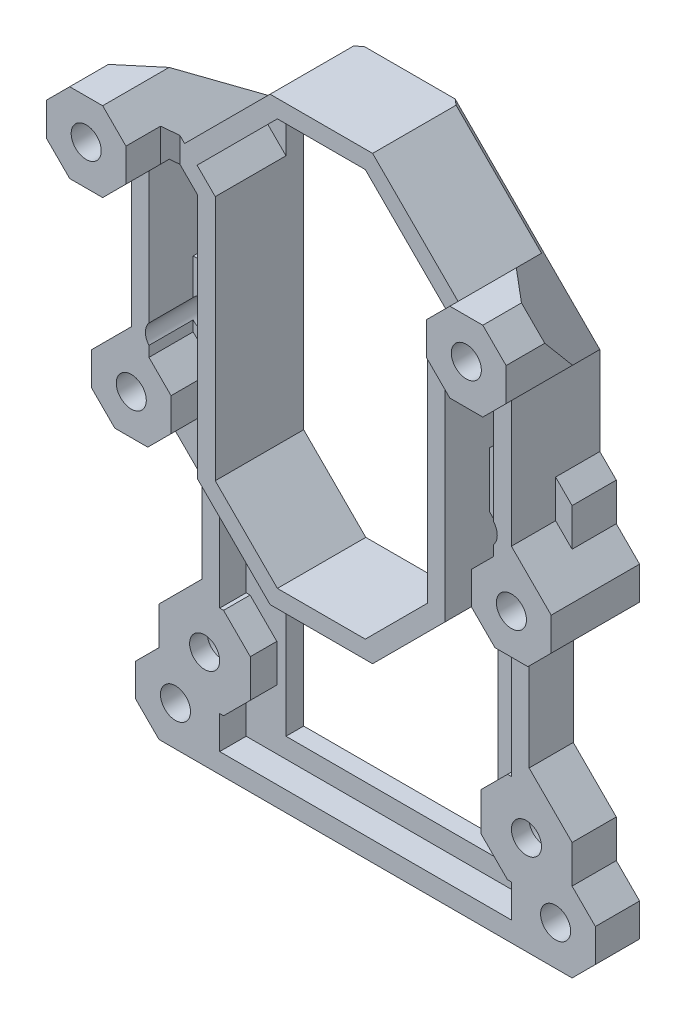
from build123d import *

# Parameters (mm, degrees)
SKETCH5_R               = 1.6999999999999995
BOSS_EXTRUDE1_DEPTH     = 2
SKETCH9_R               = 1.6999999999999995
BOSS_EXTRUDE3_DEPTH     = 3
SKETCH10_R              = 1.6999999999999995
BOSS_EXTRUDE4_DEPTH     = 5
BOSS_EXTRUDE5_DEPTH     = 5.1
SKETCH13_R              = 1.6999999999999995
SUSPENSION_DOWELS_DEPTH = 3.75
TOP_ANGLE_1_DEPTH       = 25
TOP_ANGLE_2_DEPTH       = 25
CHAMFER1_SIZE           = 1
CHAMFER1_SIZE2          = 1.1917535925942147
CHAMFER1_PART_2_SIZE    = 1
CHAMFER1_PART_2_SIZE2   = 1.1917535925942147
CHAMFER1_PART_3_SIZE    = 1
CHAMFER1_PART_3_SIZE2   = 1.1917535925942147
CHAMFER1_PART_4_SIZE    = 1
CHAMFER1_PART_4_SIZE2   = 1.1917535925942147
CHAMFER1_PART_5_SIZE    = 1
CHAMFER1_PART_5_SIZE2   = 1.1917535925942147
CHAMFER1_PART_6_SIZE    = 1
CHAMFER1_PART_6_SIZE2   = 1.1917535925942147
SKETCH18_R              = 3.0000000000000018
SKETCH18_R_2            = 2.9999999999999973
SKETCH18_R_3            = 3
SKETCH18_R_4            = 2.999999999999999
M3_HEAD_HOLES_DEPTH     = 3


with BuildPart() as part:
    # Sketch5 → Boss-Extrude1 (new body)
    with BuildSketch(Plane.XY):
        Polygon((19.636038969321074, -4.4999999999999964), (-19.636038969321074, -4.4999999999999964), (-23.363961030678926, -4.499999999999997), (-25.999999999999996, -1.8639610306789332), (-25.999999999999996, 1.863961030678925), (-23.36396103067893, 4.5), (-23.363961030678933, 8.77796538894672), (-20.33898269447335, 11.802943725152302), (-18.499999999999996, 13.641926419625662), (-18.500000000000004, 23.63603896932108), (-23.363961030678926, 28.499999999999996), (-25.999999999999996, 31.13603896932107), (-26, 34.86396103067893), (-23.363961030678926, 37.5), (-23.363961030678926, 41.7779653889467), (-21.5, 43.64192641962563), (-21.5, 53.63603896932107), (-23.363961030678908, 55.499999999999964), (-26.000000000000004, 58.13603896932106), (-26.000000000000004, 61.86396103067894), (-23.36396103067892, 64.50000000000001), (-19.63603896932107, 64.50000000000001), (-16.999999999999986, 61.86396103067893), (-15.4675144212722, 60.33147545195113), (-5.798989873223339, 69.99999999999999), (5.798989873223339, 69.99999999999999), (15.4675144212722, 60.33147545195113), (16.999999999999986, 61.86396103067893), (19.63603896932107, 64.50000000000001), (23.36396103067892, 64.50000000000001), (26.000000000000004, 61.86396103067894), (26.000000000000004, 58.13603896932106), (23.363961030678908, 55.499999999999964), (21.5, 53.63603896932107), (21.5, 43.64192641962563), (23.363961030678926, 41.7779653889467), (23.363961030678926, 37.5), (26, 34.86396103067893), (25.999999999999996, 31.13603896932107), (23.363961030678926, 28.499999999999996), (18.500000000000004, 23.63603896932108), (18.499999999999996, 13.641926419625662), (20.33898269447335, 11.802943725152302), (23.363961030678933, 8.77796538894672), (23.36396103067893, 4.5), (25.999999999999996, 1.863961030678925), (25.999999999999996, -1.8639610306789332), (23.363961030678926, -4.499999999999997), align=None)
        with Locations((-18.2, 39.638982694473334)):
            Circle(SKETCH5_R, mode=Mode.SUBTRACT)
        with Locations((-18.199999999999996, 6.638982694473367)):
            Circle(SKETCH5_R, mode=Mode.SUBTRACT)
        with Locations(Location((18.199999999999996, 6.638982694473367, 0), (0, 0, 180))):
            Circle(SKETCH5_R, mode=Mode.SUBTRACT)
        with Locations(Location((18.2, 39.638982694473334, 0), (0, 0, 180))):
            Circle(SKETCH5_R, mode=Mode.SUBTRACT)
        Polygon((4.9705627484771515, 67.99999999999999), (-4.9705627484771515, 67.99999999999999), (-12.000000000000004, 60.970562748477136), (-11.999999999999998, 34), (-11.999999999999998, 29.02943725152283), (-4.9705627484771, 22.000000000000007), (4.9705627484771, 22.000000000000007), (11.999999999999998, 29.02943725152283), (12.000000000000002, 56.863961030678944), (12.000000000000004, 60.970562748477136), align=None, mode=Mode.SUBTRACT)
        Polygon((-5.798989873223333, 20.000000000000004), (5.798989873223333, 20.000000000000004), (11.999999999999998, 26.2010101267766), (12.000000000000002, 0), (-12.000000000000002, 0), (-11.999999999999998, 26.2010101267766), align=None, mode=Mode.SUBTRACT)
    extrude(amount=BOSS_EXTRUDE1_DEPTH)

    # Sketch9 → Boss-Extrude3 (add)
    with BuildSketch(Plane.XY.offset(2)):
        Polygon((5.798989873223339, 69.99999999999999), (-5.798989873223339, 69.99999999999999), (-15.4675144212722, 60.33147545195113), (-16.999999999999986, 61.86396103067893), (-19.63603896932107, 64.50000000000001), (-23.36396103067892, 64.50000000000001), (-26.000000000000004, 61.86396103067894), (-26.000000000000004, 58.13603896932106), (-23.363961030678908, 55.499999999999964), (-21.5, 53.63603896932107), (-21.5, 43.64192641962563), (-23.363961030678926, 41.7779653889467), (-23.363961030678926, 37.5), (-26, 34.86396103067893), (-25.999999999999996, 31.13603896932107), (-23.363961030678926, 28.499999999999996), (-18.500000000000004, 23.63603896932108), (-18.499999999999996, 13.641926419625662), (-20.33898269447335, 11.802943725152302), (-23.363961030678933, 8.77796538894672), (-23.36396103067893, 4.5), (-25.999999999999996, 1.863961030678925), (-25.999999999999996, -1.8639610306789332), (-23.363961030678926, -4.499999999999997), (-19.636038969321074, -4.4999999999999964), (19.636038969321074, -4.4999999999999964), (23.363961030678926, -4.499999999999997), (25.999999999999996, -1.8639610306789332), (25.999999999999996, 1.863961030678925), (23.36396103067893, 4.5), (23.363961030678933, 8.77796538894672), (20.33898269447335, 11.802943725152302), (18.499999999999996, 13.641926419625662), (18.500000000000004, 23.63603896932108), (23.363961030678926, 28.499999999999996), (25.999999999999996, 31.13603896932107), (26, 34.86396103067893), (23.363961030678926, 37.5), (23.363961030678926, 41.7779653889467), (21.5, 43.64192641962563), (21.5, 53.63603896932107), (23.363961030678908, 55.499999999999964), (26.000000000000004, 58.13603896932106), (26.000000000000004, 61.86396103067894), (23.36396103067892, 64.50000000000001), (19.63603896932107, 64.50000000000001), (16.999999999999986, 61.86396103067893), (15.4675144212722, 60.33147545195113), align=None)
        with Locations((-21.5, 0)):
            Circle(SKETCH9_R, mode=Mode.SUBTRACT)
        with Locations((-21.5, 33)):
            Circle(SKETCH9_R, mode=Mode.SUBTRACT)
        with Locations((-18.2, 39.638982694473334)):
            Circle(SKETCH9_R, mode=Mode.SUBTRACT)
        with Locations((-18.199999999999996, 6.638982694473367)):
            Circle(SKETCH9_R, mode=Mode.SUBTRACT)
        with Locations(Location((18.199999999999996, 6.638982694473367, 0), (0, 0, 180))):
            Circle(SKETCH9_R, mode=Mode.SUBTRACT)
        with Locations(Location((18.2, 39.638982694473334, 0), (0, 0, 180))):
            Circle(SKETCH9_R, mode=Mode.SUBTRACT)
        with Locations(Location((21.5, 33, 0), (0, 0, 180))):
            Circle(SKETCH9_R, mode=Mode.SUBTRACT)
        with Locations(Location((21.5, 0, 0), (0, 0, 180))):
            Circle(SKETCH9_R, mode=Mode.SUBTRACT)
        Polygon((4.9705627484771515, 67.99999999999999), (-4.9705627484771515, 67.99999999999999), (-14.053300858899126, 58.91726188957801), (-12.000000000000002, 56.863961030678944), (-11.999999999999998, 29.02943725152283), (-4.9705627484771, 22.000000000000007), (4.9705627484771, 22.000000000000007), (11.999999999999998, 29.02943725152283), (12.000000000000002, 56.863961030678944), (14.053300858899126, 58.91726188957801), align=None, mode=Mode.SUBTRACT)
        Polygon((16.5, -2.249999999999999), (-16.5, -2.249999999999999), (-16.5, 1.4750216637944287), (-16.061017305526637, 1.4750216637944285), (-13.036038969321057, 4.500000000000007), (-13.036038969321057, 8.777965388946727), (-16.061017305526633, 11.802943725152302), (-16.5, 11.802943725152302), (-16.5, 34.47502166379441), (-16.061017305526644, 34.47502166379441), (-13.999999999999998, 36.536038969321055), (-13.999999999999995, 28.201010126776577), (-11.999999999999998, 26.2010101267766), (-5.798989873223333, 20.000000000000004), (5.798989873223333, 20.000000000000004), (11.999999999999998, 26.2010101267766), (13.999999999999995, 28.201010126776577), (13.999999999999998, 36.536038969321055), (16.061017305526644, 34.47502166379441), (16.5, 34.47502166379441), (16.5, 11.802943725152302), (16.061017305526633, 11.802943725152302), (13.036038969321057, 8.777965388946727), (13.036038969321057, 4.500000000000007), (16.061017305526637, 1.4750216637944285), (16.5, 1.4750216637944287), align=None, mode=Mode.SUBTRACT)
        Polygon((-14, 56.03553390593274), (-13.999999999999998, 42.74192641962563), (-16.06101730552664, 44.80294372515226), (-19.500000000000004, 44.80294372515227), (-19.500000000000004, 55.63603896932105), (-16.999999999999986, 58.136038969321056), (-16.550252531694156, 58.585786437626886), align=None, mode=Mode.SUBTRACT)
        Polygon((19.500000000000004, 44.80294372515227), (19.500000000000004, 55.63603896932105), (16.999999999999986, 58.136038969321056), (16.550252531694156, 58.585786437626886), (14, 56.03553390593274), (13.999999999999998, 42.74192641962563), (16.06101730552664, 44.80294372515226), align=None, mode=Mode.SUBTRACT)
    extrude(amount=BOSS_EXTRUDE3_DEPTH)

    # Sketch10 → Boss-Extrude4 (add)
    with BuildSketch(Plane.XY.offset(5)):
        with BuildLine():
            Line((19.500000000000004, 40.73442780948366), (19.500000000000004, 55.63603896932105))
            Line((19.500000000000004, 55.63603896932105), (16.999999999999986, 58.136038969321056))
            Line((16.999999999999986, 58.136038969321056), (16.550252531694156, 58.585786437626886))
            Line((16.550252531694156, 58.585786437626886), (14, 56.03553390593274))
            Line((14, 56.03553390593274), (13.999999999999995, 28.201010126776577))
            Line((13.999999999999995, 28.201010126776577), (11.999999999999998, 26.2010101267766))
            Line((11.999999999999998, 26.2010101267766), (5.798989873223333, 20.000000000000004))
            Line((5.798989873223333, 20.000000000000004), (-5.798989873223335, 20.000000000000004))
            Line((-5.798989873223335, 20.000000000000004), (-11.999999999999998, 26.2010101267766))
            Line((-11.999999999999998, 26.2010101267766), (-13.999999999999995, 28.201010126776573))
            Line((-13.999999999999995, 28.201010126776573), (-14, 56.03553390593274))
            Line((-14, 56.03553390593274), (-16.550252531694156, 58.585786437626886))
            Line((-16.550252531694156, 58.585786437626886), (-16.999999999999986, 58.136038969321056))
            Line((-16.999999999999986, 58.136038969321056), (-19.500000000000004, 55.63603896932105))
            Line((-19.500000000000004, 55.63603896932105), (-19.500000000000004, 40.73442780948366))
            ThreePointArc((-19.500000000000004, 40.73442780948366), (-19.9, 39.638982694473334), (-19.500000000000004, 38.543537579463006))
            Line((-19.500000000000004, 38.543537579463006), (-19.500000000000004, 37.36396103067894))
            Line((-19.500000000000004, 37.36396103067894), (-17, 34.86396103067892))
            Line((-17, 34.86396103067892), (-17, 31.136038969321078))
            Line((-17, 31.136038969321078), (-19.636038969321078, 28.5))
            Line((-19.636038969321078, 28.5), (-23.363961030678926, 28.499999999999996))
            Line((-23.363961030678926, 28.499999999999996), (-25.999999999999996, 31.13603896932107))
            Line((-25.999999999999996, 31.13603896932107), (-26, 34.86396103067893))
            Line((-26, 34.86396103067893), (-23.363961030678926, 37.5))
            Line((-23.363961030678926, 37.5), (-21.5, 39.36396103067895))
            Line((-21.5, 39.36396103067895), (-21.5, 53.63603896932107))
            Line((-21.5, 53.63603896932107), (-23.363961030678908, 55.499999999999964))
            Line((-23.363961030678908, 55.499999999999964), (-26.000000000000004, 58.13603896932106))
            Line((-26.000000000000004, 58.13603896932106), (-26.000000000000004, 61.86396103067894))
            Line((-26.000000000000004, 61.86396103067894), (-23.36396103067892, 64.50000000000001))
            Line((-23.36396103067892, 64.50000000000001), (-19.63603896932107, 64.50000000000001))
            Line((-19.63603896932107, 64.50000000000001), (-16.999999999999986, 61.86396103067893))
            Line((-16.999999999999986, 61.86396103067893), (-15.4675144212722, 60.33147545195113))
            Line((-15.4675144212722, 60.33147545195113), (-5.798989873223339, 69.99999999999999))
            Line((-5.798989873223339, 69.99999999999999), (5.798989873223339, 69.99999999999999))
            Line((5.798989873223339, 69.99999999999999), (15.4675144212722, 60.33147545195113))
            Line((15.4675144212722, 60.33147545195113), (16.999999999999986, 61.86396103067893))
            Line((16.999999999999986, 61.86396103067893), (19.63603896932107, 64.50000000000001))
            Line((19.63603896932107, 64.50000000000001), (23.36396103067892, 64.50000000000001))
            Line((23.36396103067892, 64.50000000000001), (26.000000000000004, 61.86396103067894))
            Line((26.000000000000004, 61.86396103067894), (26.000000000000004, 58.13603896932106))
            Line((26.000000000000004, 58.13603896932106), (23.363961030678908, 55.499999999999964))
            Line((23.363961030678908, 55.499999999999964), (21.5, 53.63603896932107))
            Line((21.5, 53.63603896932107), (21.5, 39.36396103067895))
            Line((21.5, 39.36396103067895), (23.363961030678926, 37.5))
            Line((23.363961030678926, 37.5), (26, 34.86396103067893))
            Line((26, 34.86396103067893), (25.999999999999996, 31.13603896932107))
            Line((25.999999999999996, 31.13603896932107), (23.363961030678926, 28.499999999999996))
            Line((23.363961030678926, 28.499999999999996), (19.636038969321078, 28.5))
            Line((19.636038969321078, 28.5), (17, 31.136038969321078))
            Line((17, 31.136038969321078), (17, 34.86396103067892))
            Line((17, 34.86396103067892), (19.500000000000004, 37.36396103067894))
            Line((19.500000000000004, 37.36396103067894), (19.500000000000004, 38.543537579463006))
            ThreePointArc((19.500000000000004, 38.543537579463006), (19.9, 39.638982694473334), (19.500000000000004, 40.73442780948366))
        make_face()
        with Locations((-21.5, 33)):
            Circle(SKETCH10_R, mode=Mode.SUBTRACT)
        with Locations(Location((21.5, 33, 0), (0, 0, 180))):
            Circle(SKETCH10_R, mode=Mode.SUBTRACT)
        Polygon((4.9705627484771515, 67.99999999999999), (-4.9705627484771515, 67.99999999999999), (-14.053300858899126, 58.91726188957801), (-12.000000000000002, 56.863961030678944), (-11.999999999999998, 29.029437251522825), (-4.970562748477101, 22.000000000000007), (4.9705627484771, 22.000000000000007), (11.999999999999998, 29.02943725152283), (12.000000000000002, 56.863961030678944), (14.053300858899126, 58.91726188957801), align=None, mode=Mode.SUBTRACT)
    extrude(amount=BOSS_EXTRUDE4_DEPTH)

    # Sketch12 → Boss-Extrude5 (add)
    with BuildSketch(Plane.XY.offset(10)):
        Polygon((-26.000000000000004, 58.13603896932106), (-23.363961030678908, 55.499999999999964), (-19.636038969321078, 55.499999999999964), (-16.999999999999986, 58.136038969321056), (-16.999999999999986, 61.86396103067893), (-19.63603896932107, 64.50000000000001), (-23.36396103067892, 64.50000000000001), (-26.000000000000004, 61.86396103067894), align=None)
        Polygon((16.999999999999986, 58.136038969321056), (16.999999999999986, 61.86396103067893), (19.63603896932107, 64.50000000000001), (23.36396103067892, 64.50000000000001), (26.000000000000004, 61.86396103067894), (26.000000000000004, 58.13603896932106), (23.363961030678908, 55.499999999999964), (19.636038969321078, 55.499999999999964), align=None)
    extrude(amount=BOSS_EXTRUDE5_DEPTH)

    # Sketch13 → Suspension Dowels (cut)
    with BuildSketch(Plane.XY.offset(15.1)):
        with Locations((-21.500000000000004, 60)):
            Circle(SKETCH13_R)
        with Locations(Location((21.500000000000004, 60, 0), (0, 0, 180))):
            Circle(SKETCH13_R)
    extrude(amount=-SUSPENSION_DOWELS_DEPTH, mode=Mode.SUBTRACT)

    # Sketch15 → Top Angle 1 (cut, symmetric)
    with BuildSketch(Plane(origin=(19.249999999999986, 19.24999999999993, 0), x_dir=(0, 0, -1), z_dir=(0.7071067811865485, 0.7071067811865467, 0))):
        Polygon((0, 53.12920266670365), (-15.320888862379586, 65.9849548604344), (-8.893012765514198, 73.6453992916242), (6.427876096865383, 60.78964709789344), align=None)
    extrude(amount=TOP_ANGLE_1_DEPTH, both=True, mode=Mode.SUBTRACT)

    # Sketch16 → Top Angle 2 (cut, symmetric)
    with BuildSketch(Plane(origin=(-19.249999999999908, 19.249999999999712, 0), x_dir=(0, 0, 1), z_dir=(-0.7071067811865509, 0.7071067811865441, 0))):
        Polygon((0, 53.129202666703755), (15.32088886237958, 65.98495486043451), (8.8930127655142, 73.64539929162432), (-6.427876096865378, 60.78964709789354), align=None)
    extrude(amount=TOP_ANGLE_2_DEPTH, both=True, mode=Mode.SUBTRACT)

    # Chamfer1
    chamfer1_edges = [part.edges().sort_by_distance(p)[0] for p in [
        (-18.025126265847078, 57.11091270347397, 2),
    ]]
    chamfer1_side = [part.faces().sort_by_distance(p)[0] for p in [
        (-18.13142778935896, 57.004611179962076, 8.37723147645248),
    ]]
    chamfer(chamfer1_edges, length=CHAMFER1_SIZE, length2=CHAMFER1_SIZE2, reference=chamfer1_side[0])

    # Chamfer1 part 2
    chamfer1_part_2_edges = [part.edges().sort_by_distance(p)[0] for p in [
        (18.025126265847078, 57.11091270347397, 2),
    ]]
    chamfer1_part_2_side = [part.faces().sort_by_distance(p)[0] for p in [
        (18.131427789358963, 57.00461117996208, 8.37723147645248),
    ]]
    chamfer(chamfer1_part_2_edges, length=CHAMFER1_PART_2_SIZE, length2=CHAMFER1_PART_2_SIZE2, reference=chamfer1_part_2_side[0])

    # Chamfer1 part 3
    chamfer1_part_3_edges = [part.edges().sort_by_distance(p)[0] for p in [
        (-21.5, 28.5, 5),
        (21.5, 28.499999999999996, 5),
    ]]
    chamfer1_part_3_side = [part.faces().sort_by_distance(p)[0] for p in [
        (20.425286314663868, 26.574713685336132, 5),
    ]]
    chamfer(chamfer1_part_3_edges, length=CHAMFER1_PART_3_SIZE, length2=CHAMFER1_PART_3_SIZE2, reference=chamfer1_part_3_side[0])

    # Chamfer1 part 4
    chamfer1_part_4_edges = [part.edges().sort_by_distance(p)[0] for p in [
        (-21.499999999999993, 55.499999999999964, 10),
    ]]
    chamfer1_part_4_side = [part.faces().sort_by_distance(p)[0] for p in [
        (-21.161819058590364, 38.46008255633416, 10),
    ]]
    chamfer(chamfer1_part_4_edges, length=CHAMFER1_PART_4_SIZE, length2=CHAMFER1_PART_4_SIZE2, reference=chamfer1_part_4_side[0])

    # Chamfer1 part 5
    chamfer1_part_5_edges = [part.edges().sort_by_distance(p)[0] for p in [
        (-16.999999999999986, 59.99999999999999, 10),
        (16.999999999999986, 59.99999999999999, 10),
    ]]
    chamfer1_part_5_side = [part.faces().sort_by_distance(p)[0] for p in [
        (16.395351341686748, 59.99999999999999, 10),
    ]]
    chamfer(chamfer1_part_5_edges, length=CHAMFER1_PART_5_SIZE, length2=CHAMFER1_PART_5_SIZE2, reference=chamfer1_part_5_side[0])

    # Chamfer1 part 6
    chamfer1_part_6_edges = [part.edges().sort_by_distance(p)[0] for p in [
        (21.499999999999993, 55.499999999999964, 10),
    ]]
    chamfer1_part_6_side = [part.faces().sort_by_distance(p)[0] for p in [
        (21.16181905859036, 38.46008255633416, 10),
    ]]
    chamfer(chamfer1_part_6_edges, length=CHAMFER1_PART_6_SIZE, length2=CHAMFER1_PART_6_SIZE2, reference=chamfer1_part_6_side[0])

    # Sketch18 → M3 Head Holes (cut)
    with BuildSketch(Plane(origin=(0, 0, 0), x_dir=(-1, 0, 0), z_dir=(0, 0, -1))):
        with Locations((18.2, 39.638982694473334)):
            Circle(SKETCH18_R)
        with Locations((18.199999999999996, 6.638982694473367)):
            Circle(SKETCH18_R_2)
        with Locations(Location((-18.2, 39.638982694473334, 0), (0, 0, 180))):
            Circle(SKETCH18_R_3)
        with Locations(Location((-18.199999999999996, 6.638982694473367, 0), (0, 0, 180))):
            Circle(SKETCH18_R_4)
    extrude(amount=-M3_HEAD_HOLES_DEPTH, mode=Mode.SUBTRACT)


solid = part.part
